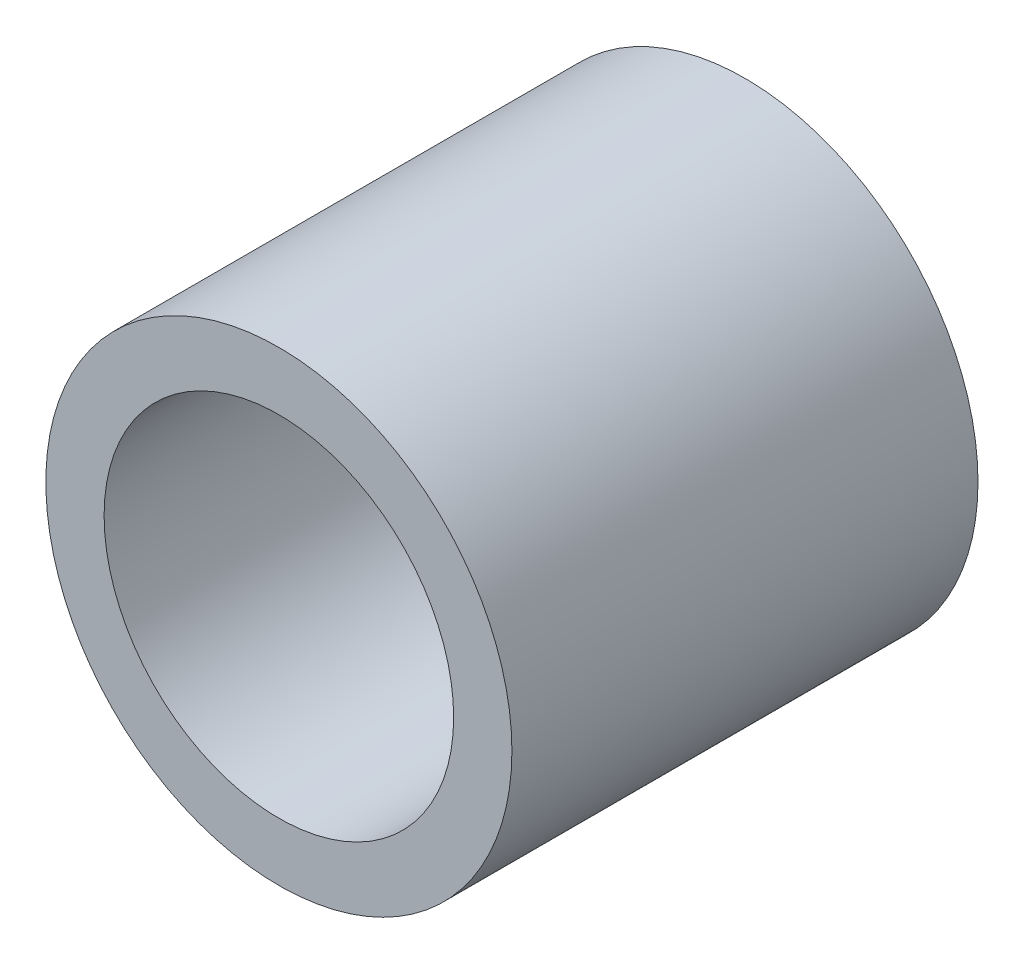
from build123d import *

# Parameters (mm, degrees)
SKETCH1_R           = 12.7
SKETCH1_R_2         = 9.525
BOSS_EXTRUDE1_DEPTH = 12.7


with BuildPart() as part:
    # Sketch1 → Boss-Extrude1 (new, symmetric)
    with BuildSketch(Plane.XY):
        Circle(SKETCH1_R)
        Circle(SKETCH1_R_2, mode=Mode.SUBTRACT)
    extrude(amount=BOSS_EXTRUDE1_DEPTH, both=True)


solid = part.part
